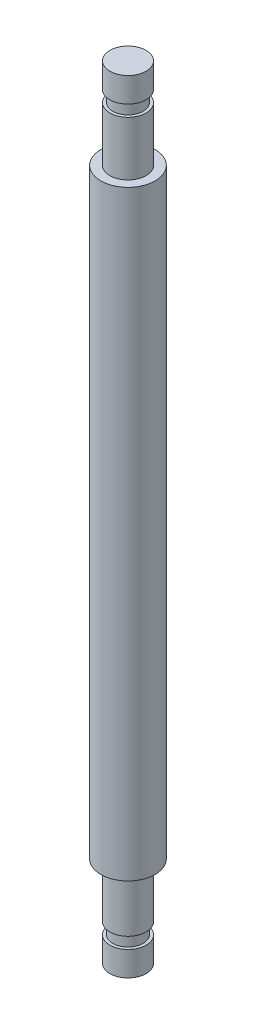
from build123d import *

# Parameters (mm, degrees)
SKETCH1_R           = 3.175
BOSS_EXTRUDE1_DEPTH = 137.2
BOSS_EXTRUDE2_START = -15.88
SKETCH2_R           = 4.7625
BOSS_EXTRUDE2_DEPTH = 105.45
CUT_EXTRUDE1_START  = 9.53
SKETCH4_R           = 3.175
SKETCH4_R_2         = 2.665
CUT_EXTRUDE1_DEPTH  = 2


with BuildPart() as part:
    # Sketch1 → Boss-Extrude1 (new body)
    with BuildSketch(Plane(origin=(0, 0, 0), x_dir=(1, 0, 0), z_dir=(0, 1, 0))):
        with Locations(Location((0, 0, 0), (0, 0, 270))):
            Circle(SKETCH1_R)
    extrude(amount=BOSS_EXTRUDE1_DEPTH)

    # Sketch2 → Boss-Extrude2 (add)
    with BuildSketch(Plane(origin=(0, 137.2, 0), x_dir=(1, 0, 0), z_dir=(0, 1, 0)).offset(BOSS_EXTRUDE2_START)):
        with Locations(Location((0, 0, 0), (0, 0, 270))):
            Circle(SKETCH2_R)
    extrude(amount=-BOSS_EXTRUDE2_DEPTH)

    # Sketch4 → Cut-Extrude1 (cut)
    with BuildSketch(Plane(origin=(0, 121.32, 0), x_dir=(1, 0, 0), z_dir=(0, 1, 0)).offset(CUT_EXTRUDE1_START)):
        with Locations(Location((0, 0, 0), (0, 0, 270))):
            Circle(SKETCH4_R)
        with Locations(Location((0, 0, 0), (0, 0, 270))):
            Circle(SKETCH4_R_2, mode=Mode.SUBTRACT)
    cut_extrude1 = extrude(amount=CUT_EXTRUDE1_DEPTH, mode=Mode.SUBTRACT)

    # Mirror1: Cut-Extrude1 across plane
    add(cut_extrude1.mirror(Plane.ZX.offset(68.595)), mode=Mode.SUBTRACT)


solid = part.part
